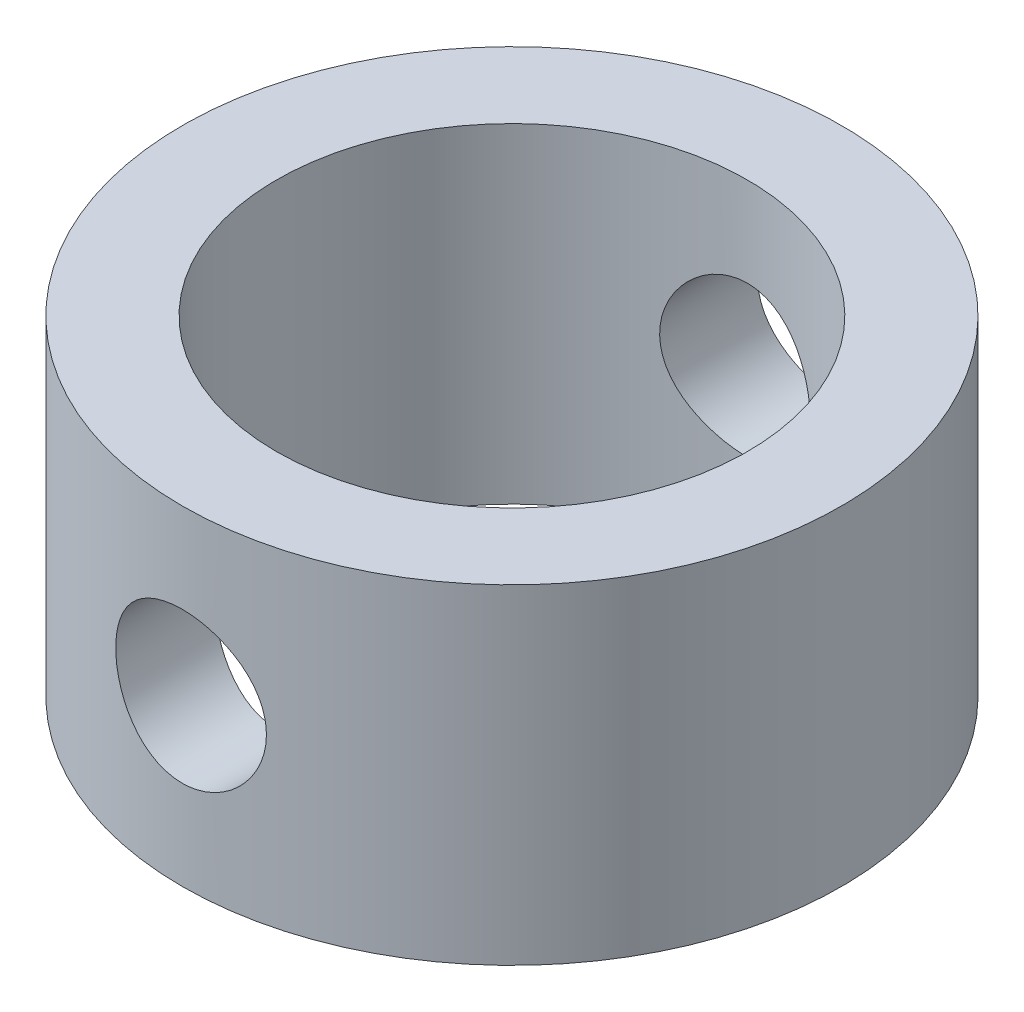
from build123d import *

# Parameters (mm, degrees)
ESBO_O1_R                  = 7
ESBO_O1_R_2                = 5
RESSALTO_EXTRUS_O1_DEPTH   = 7
CORTE_EXTRUS_O1_DEPTH      = 13.124355653
CORTE_EXTRUS_O1_DEPTH_BACK = 13.124355653
ESBO_O2_R                  = 1.6


with BuildPart() as part:
    # Esboço1 → Ressalto-extrusão1 (new body)
    with BuildSketch(Plane(origin=(0, 0, 0), x_dir=(1, 0, 0), z_dir=(0, 1, 0))):
        with Locations(Location((0, 0, 0), (0, 0, 270))):
            Circle(ESBO_O1_R)
        with Locations(Location((0, 0, 0), (0, 0, 270))):
            Circle(ESBO_O1_R_2, mode=Mode.SUBTRACT)
    extrude(amount=RESSALTO_EXTRUS_O1_DEPTH)

    # Esboço2 → Corte-extrusão1 (cut, two sides: drawn at the far end of the back side and taken through both)
    with BuildSketch(Plane.XY.offset(-CORTE_EXTRUS_O1_DEPTH_BACK)):
        with Locations((0, 3.5)):
            Circle(ESBO_O2_R)
    extrude(amount=CORTE_EXTRUS_O1_DEPTH + CORTE_EXTRUS_O1_DEPTH_BACK, mode=Mode.SUBTRACT)


solid = part.part
